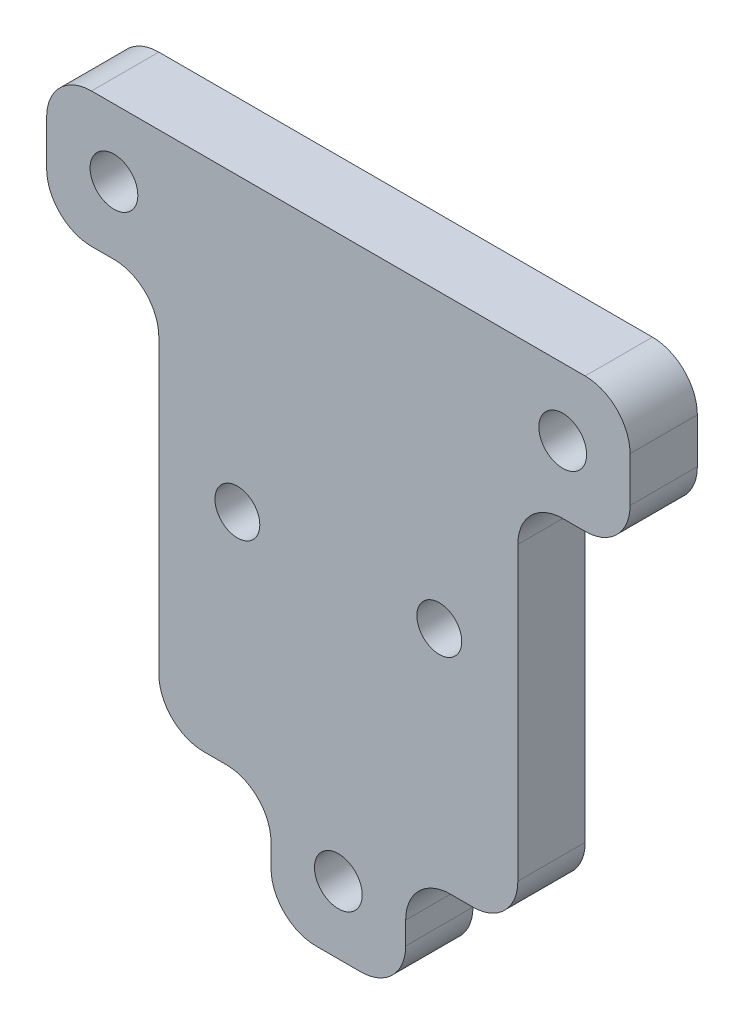
from build123d import *

# Parameters (mm, degrees)
SKETCH1_W                   = 50.8
SKETCH1_H                   = 101.6
BOSS_EXTRUDE1_DEPTH         = 9.525
F_3_0_3_DIAMETER_HOLE1_D    = 3
SKETCH4_W                   = 15.875
SKETCH4_H                   = 19.05
SKETCH4_W_2                 = 19.05
SKETCH4_H_2                 = 15.875
BOSS_EXTRUDE2_DEPTH         = 9.525
F_1_4_CLEARANCE_HOLE1_D     = 6.7564
FILLET1_R                   = 6.35
SKETCH7_W                   = 63.5
SKETCH7_H                   = 28.575
CUT_EXTRUDE1_DEPTH          = 122.89684676
F_1_4_0_25_DIAMETER_HOLE1_D = 6.35


with BuildPart() as part:
    # Sketch1 → Boss-Extrude1 (new body)
    with BuildSketch(Plane.XY):
        with Locations((25.4, 50.8)):
            Rectangle(SKETCH1_W, SKETCH1_H)
    extrude(amount=BOSS_EXTRUDE1_DEPTH)

    # Ø3.0 (3) Diameter Hole1 (through all)
    with Locations(Plane.XY.offset(9.525)):
        with Locations((12.899999981, 87.60000006), (37.900000019, 87.60000006)):
            Hole(F_3_0_3_DIAMETER_HOLE1_D / 2)

    # Sketch4 → Boss-Extrude2 (add)
    with BuildSketch(Plane.XY.offset(9.525)):
        with Locations((-7.9375, 63.5)):
            Rectangle(SKETCH4_W, SKETCH4_H)
        with Locations((58.7375, 63.5)):
            Rectangle(SKETCH4_W, SKETCH4_H)
        with Locations((25.4, -7.9375)):
            Rectangle(SKETCH4_W_2, SKETCH4_H_2)
    extrude(amount=-BOSS_EXTRUDE2_DEPTH)

    # 1/4 Clearance Hole1 (through all)
    with Locations(Plane.XY.offset(9.525)):
        with Locations((-6.35, 63.5), (57.15, 63.5), (25.4, -6.35)):
            Hole(F_1_4_CLEARANCE_HOLE1_D / 2)

    # Fillet1
    fillet1_edges = [part.edges().sort_by_distance(p)[0] for p in [
        (-15.875, 73.025, 4.7625),
        (-15.875, 53.975, 4.7625),
        (0, 53.975, 4.7625),
        (0, 73.025, 4.7625),
        (50.8, 53.975, 4.7625),
        (66.675, 53.975, 4.7625),
        (66.675, 73.025, 4.7625),
        (50.8, 73.025, 4.7625),
        (34.925, -15.875, 4.7625),
        (34.925, 0, 4.7625),
        (15.875, 0, 4.7625),
        (15.875, -15.875, 4.7625),
        (0, 101.6, 4.7625),
        (50.8, 101.6, 4.7625),
        (50.8, 0, 4.7625),
        (0, 0, 4.7625),
    ]]
    fillet(fillet1_edges, radius=FILLET1_R)

    # Sketch7 → Cut-Extrude1 (cut, through all)
    with BuildSketch(Plane.XY.offset(9.525)):
        with Locations((25.4, 87.3125)):
            Rectangle(SKETCH7_W, SKETCH7_H)
    extrude(amount=-CUT_EXTRUDE1_DEPTH, mode=Mode.SUBTRACT)

    # 1/4 (0.25) Diameter Hole1 (through all)
    with Locations(Plane.XY.offset(9.525)):
        with Locations((11.1125, 31.75), (39.6875, 31.75)):
            Hole(F_1_4_0_25_DIAMETER_HOLE1_D / 2)


solid = part.part
